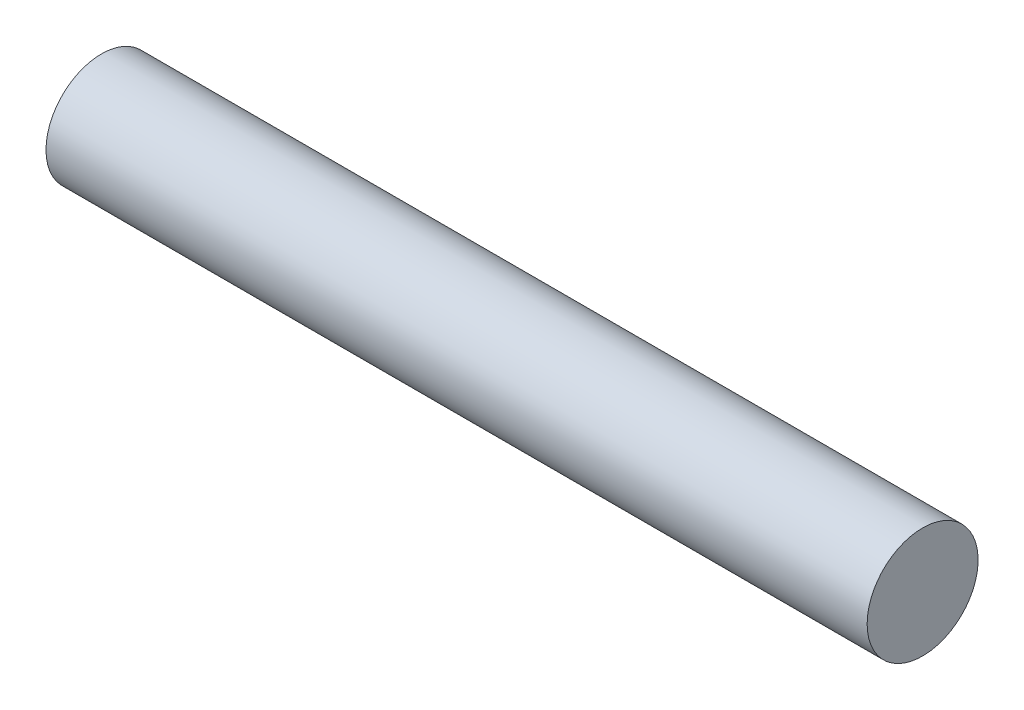
from build123d import *

# Parameters (mm, degrees)
AXIAL_PROFILE_MM_W = 37
AXIAL_PROFILE_MM_H = 2.5


with BuildPart() as part:
    # Axial profile (mm) → Full revolution (revolve)
    with BuildSketch(Plane.XY, mode=Mode.PRIVATE) as full_revolution_sk:
        with Locations((-121.5, 1.25)):
            Rectangle(AXIAL_PROFILE_MM_W, AXIAL_PROFILE_MM_H)
    revolve(full_revolution_sk.sketch.rotate(Axis((-110, 0, 0), (1, 0, 0)), 90), axis=Axis((-110, 0, 0), (1, 0, 0)))


solid = part.part
